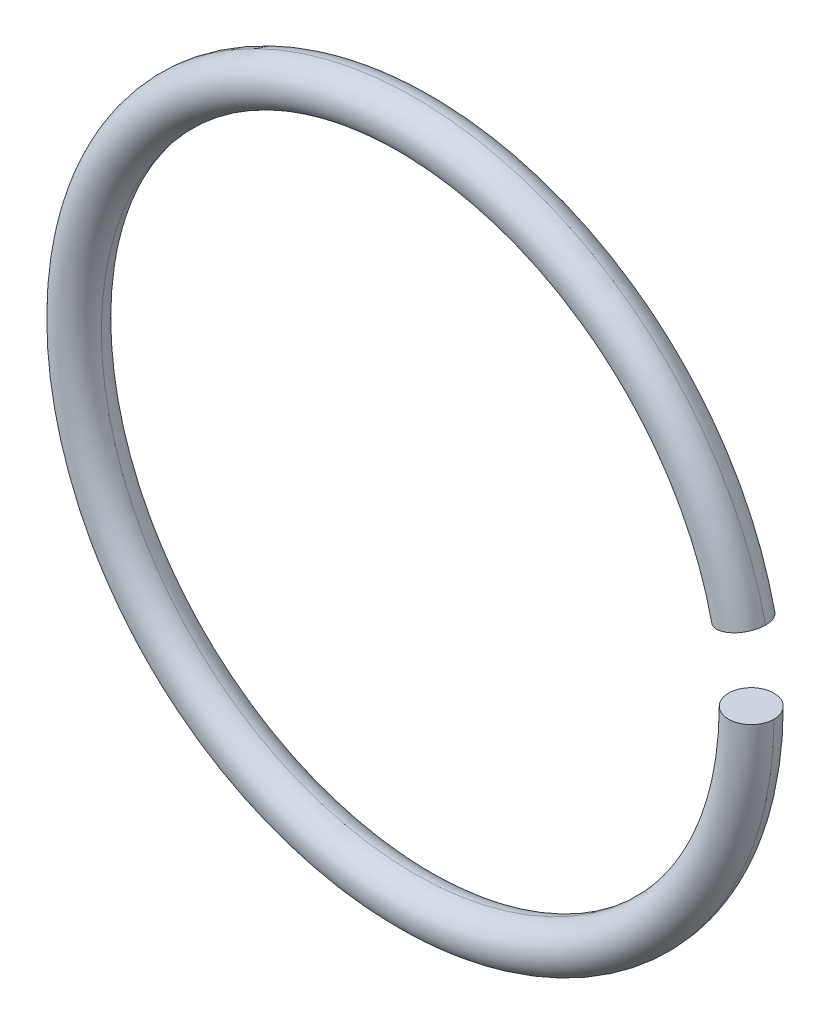
from build123d import *

# Parameters (mm, degrees)
SKETCH2_R = 1


with BuildPart() as part:
    # Sweep1: sweep along a path in Sketch1
    with BuildLine(Plane.XY) as sweep1_path:
        ThreePointArc((13.525090253, 2.982353711), (-13.768532965, -1.5), (13.85, 0))
    # Sketch2 → Sweep1 (sweep)
    with BuildSketch(Plane(origin=(0, 0, 0), x_dir=(1, 0, 0), z_dir=(0, 1, 0))):
        with Locations((14.85, 0)):
            Circle(SKETCH2_R)
    sweep(path=sweep1_path.line)


solid = part.part
